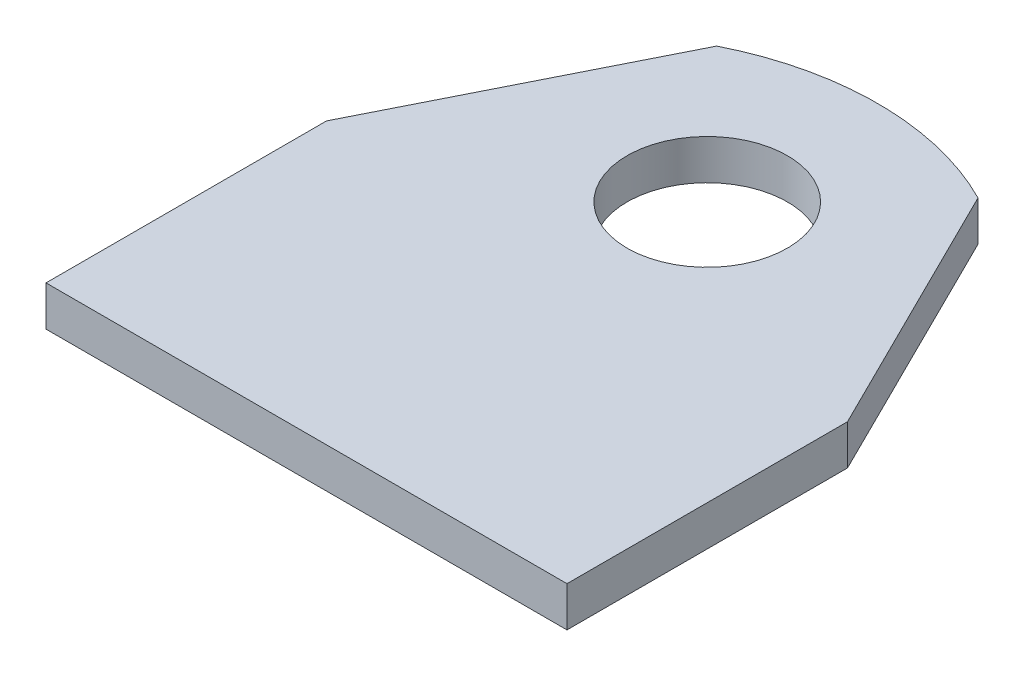
from build123d import *

# Parameters (mm, degrees)
SKETCH1_R           = 10
BOSS_EXTRUDE1_DEPTH = 5


with BuildPart() as part:
    # Sketch1 → Boss-Extrude1 (new body)
    with BuildSketch(Plane(origin=(0, 0, 0), x_dir=(1, 0, 0), z_dir=(0, 1, 0))):
        with BuildLine():
            Line((0, 35), (0, 0))
            Line((0, 0), (65, 0))
            Line((65, 0), (65, 35))
            Line((65, 35), (48.959951679, 67.319800692))
            ThreePointArc((48.959951679, 67.319800692), (32.618975384, 71.269620496), (16.252437814, 67.427091283))
            Line((16.252437814, 67.427091283), (0, 35))
        make_face()
        with Locations(Location((32.5, 50, 0), (0, 0, 270))):
            Circle(SKETCH1_R, mode=Mode.SUBTRACT)
    extrude(amount=BOSS_EXTRUDE1_DEPTH)


solid = part.part
